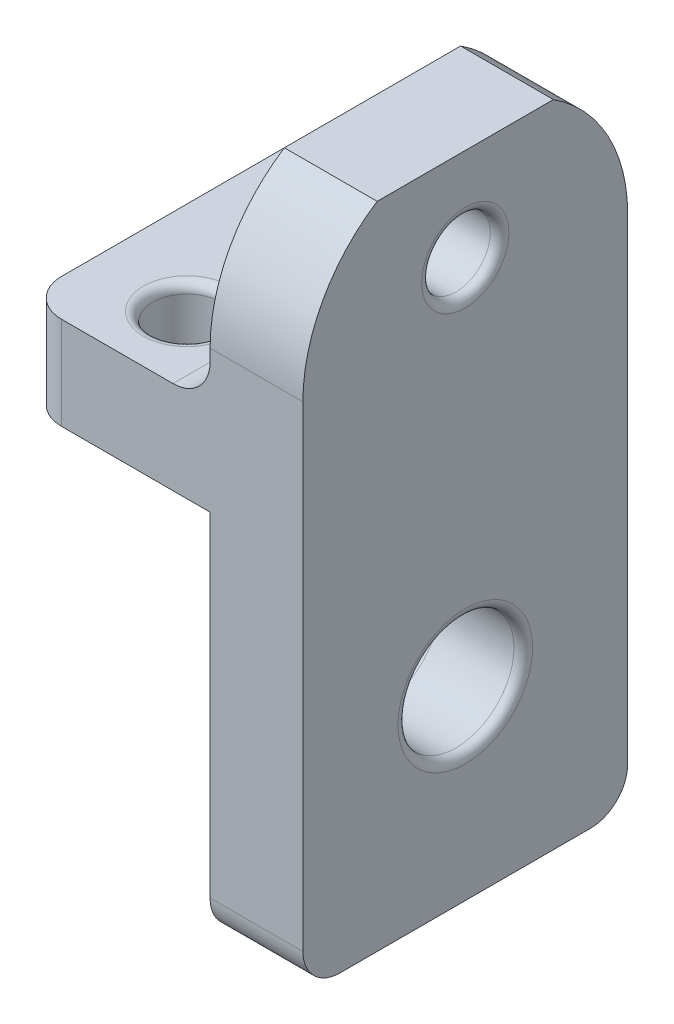
from build123d import *

# Parameters (mm, degrees)
BOSS_EXTRUDE1_DEPTH     = 11.1125
CUT_EXTRUDE1_DEPTH      = 36.956086498
CUT_EXTRUDE1_DEPTH_BACK = 36.956086498
SKETCH2_R               = 2.3368
CUT_EXTRUDE2_DEPTH      = 34.638521909
CUT_EXTRUDE2_DEPTH_BACK = 34.638521909
SKETCH3_R               = 2.3495
SKETCH3_R_2             = 3.96875
FILLET1_R               = 2.54
FILLET2_R               = 0.635
FILLET3_R               = 2.54
CUT_EXTRUDE3_DEPTH      = 34.638521909
CUT_EXTRUDE3_DEPTH_BACK = 34.638521909


with BuildPart() as part:
    # Sketch1 → Boss-Extrude1 (new, symmetric)
    with BuildSketch(Plane.XY):
        Polygon((0, 0), (-12.7, 0), (-12.7, 6.35), (0, 6.35), (0, 19.05), (6.35, 19.05), (6.35, -25.4), (0, -25.4), align=None)
    extrude(amount=BOSS_EXTRUDE1_DEPTH, both=True)

    # Sketch2 → Cut-Extrude1 (cut, two sides: drawn at the far end of the back side and taken through both)
    with BuildSketch(Plane(origin=(0, 6.35, 0), x_dir=(1, 0, 0), z_dir=(0, 1, 0)).offset(-CUT_EXTRUDE1_DEPTH_BACK)):
        with Locations(Location((-6.35, 6.35, 0), (0, 0, 270))):
            Circle(SKETCH2_R)
        with Locations(Location((-6.35, -6.35, 0), (0, 0, 270))):
            Circle(SKETCH2_R)
    extrude(amount=CUT_EXTRUDE1_DEPTH + CUT_EXTRUDE1_DEPTH_BACK, mode=Mode.SUBTRACT)

    # Sketch3 → Cut-Extrude2 (cut, two sides: drawn at the far end of the back side and taken through both)
    with BuildSketch(Plane(origin=(6.35, 0, 0), x_dir=(0, 0, -1), z_dir=(1, 0, 0)).offset(-CUT_EXTRUDE2_DEPTH_BACK)):
        with Locations((0, 12.7)):
            Circle(SKETCH3_R)
        with Locations((0, -12.7)):
            Circle(SKETCH3_R_2)
    extrude(amount=CUT_EXTRUDE2_DEPTH + CUT_EXTRUDE2_DEPTH_BACK, mode=Mode.SUBTRACT)

    # Fillet1
    fillet1_edges = [part.edges().sort_by_distance(p)[0] for p in [
        (3.175, 19.05, -11.1125),
        (3.175, -25.4, -11.1125),
        (3.175, 19.05, 11.1125),
        (-12.7, 3.175, 11.1125),
        (3.175, -25.4, 11.1125),
        (-12.7, 3.175, -11.1125),
    ]]
    fillet(fillet1_edges, radius=FILLET1_R)

    # Fillet2
    fillet2_edges = [part.edges().sort_by_distance(p)[0] for p in [
        (-6.35, 0, -8.6868),
        (-6.35, 6.35, -8.6868),
        (-6.35, 0, 4.0132),
        (-6.35, 6.35, 4.0132),
        (0, 12.7, 2.3495),
        (6.35, 12.7, 2.3495),
        (6.35, -12.7, 3.96875),
        (0, -12.7, 3.96875),
    ]]
    fillet(fillet2_edges, radius=FILLET2_R)

    # Fillet3
    fillet3_edges = [part.edges().sort_by_distance(p)[0] for p in [
        (0, 6.35, 0),
    ]]
    fillet(fillet3_edges, radius=FILLET3_R)

    # Sketch4 → Cut-Extrude3 (cut, two sides: drawn at the far end of the back side and taken through both)
    with BuildSketch(Plane(origin=(6.35, 0, 0), x_dir=(0, 0, -1), z_dir=(1, 0, 0)).offset(-CUT_EXTRUDE3_DEPTH_BACK)):
        with BuildLine():
            Line((-17.4625, 9.7155), (-11.1125, 9.7155))
            ThreePointArc((-11.1125, 9.7155), (0, 20.828), (11.1125, 9.7155))
            Line((11.1125, 9.7155), (17.4625, 9.7155))
            Line((17.4625, 9.7155), (17.4625, 22.870825691))
            Line((17.4625, 22.870825691), (-17.4625, 22.870825691))
            Line((-17.4625, 22.870825691), (-17.4625, 9.7155))
        make_face()
    extrude(amount=CUT_EXTRUDE3_DEPTH + CUT_EXTRUDE3_DEPTH_BACK, mode=Mode.SUBTRACT)


solid = part.part
